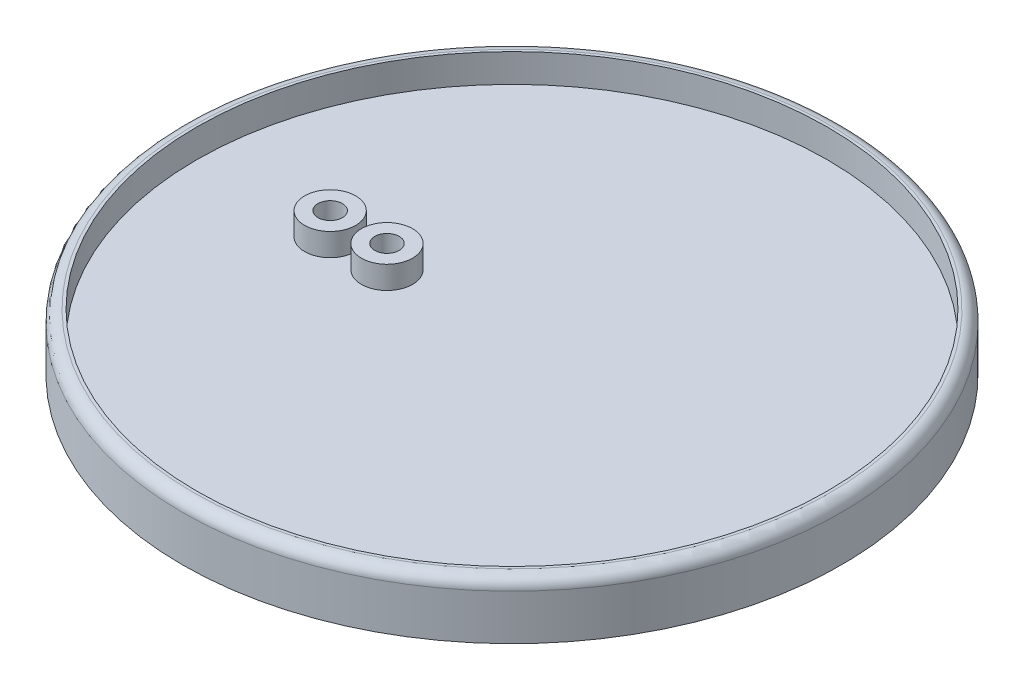
from build123d import *

# Parameters (mm, degrees)
SKETCH_1_R                            = 4.5
MOVING_POST_A_DEPTH                   = 9
SKETCH_2_R                            = 58
CUP_PLATE_D116_T5_DEPTH               = 5
SKETCH_3_R                            = 4.5
MOVING_POST_B_DEPTH                   = 9
SKETCH_4_R                            = 58
SKETCH_4_R_2                          = 55.5
DRIP_SKIRT_OD116_ID111_H10_DEPTH      = 10
SKETCH_5_R                            = 2.15
M4_MOVING_MOUNT_CLEARANCE_DEPTH       = 9
SKETCH_6_R                            = 4.5
M4_MOVING_HEAD_RECESS_D8P2_T2P7_DEPTH = 2.7
CUP_TOP_OUTER_ROUND_R2_R              = 2


with BuildPart() as part:
    # 草图1 → Moving_post_A (new body)
    with BuildSketch(Plane(origin=(0, 0, 0), x_dir=(1, 0, 0), z_dir=(0, 1, 0))):
        with Locations(Location((-22, 0, 0), (0, 0, 270))):
            Circle(SKETCH_1_R)
    extrude(amount=MOVING_POST_A_DEPTH)

    # 草图2 → Cup_plate_D116_T5 (add)
    with BuildSketch(Plane(origin=(0, 0, 0), x_dir=(1, 0, 0), z_dir=(0, 1, 0))):
        with Locations(Location((0, 0, 0), (0, 0, 270))):
            Circle(SKETCH_2_R)
    extrude(amount=CUP_PLATE_D116_T5_DEPTH)

    # 草图3 → Moving_post_B (add)
    with BuildSketch(Plane(origin=(0, 0, 0), x_dir=(1, 0, 0), z_dir=(0, 1, 0))):
        with Locations(Location((-32, 0, 0), (0, 0, 270))):
            Circle(SKETCH_3_R)
    extrude(amount=MOVING_POST_B_DEPTH)

    # 草图4 → Drip_skirt_OD116_ID111_H10 (add)
    with BuildSketch(Plane(origin=(0, 0, 0), x_dir=(1, 0, 0), z_dir=(0, 1, 0))):
        with Locations(Location((0, 0, 0), (0, 0, 270))):
            Circle(SKETCH_4_R)
        with Locations(Location((0, 0, 0), (0, 0, 270))):
            Circle(SKETCH_4_R_2, mode=Mode.SUBTRACT)
    extrude(amount=DRIP_SKIRT_OD116_ID111_H10_DEPTH)

    # 草图5 → M4_moving_mount_clearance (cut)
    with BuildSketch(Plane(origin=(0, 0, 0), x_dir=(1, 0, 0), z_dir=(0, 1, 0))):
        with Locations(Location((-22, 0, 0), (0, 0, 270))):
            Circle(SKETCH_5_R)
        with Locations(Location((-32, 0, 0), (0, 0, 270))):
            Circle(SKETCH_5_R)
    extrude(amount=M4_MOVING_MOUNT_CLEARANCE_DEPTH, mode=Mode.SUBTRACT)

    # 草图6 → M4_moving_head_recess_D8p2_T2p7 (cut)
    with BuildSketch(Plane(origin=(0, 0, 0), x_dir=(1, 0, 0), z_dir=(0, 1, 0))):
        with Locations(Location((-22, 0, 0), (0, 0, 270))):
            Circle(SKETCH_6_R)
        with Locations(Location((-32, 0, 0), (0, 0, 270))):
            Circle(SKETCH_6_R)
    extrude(amount=M4_MOVING_HEAD_RECESS_D8P2_T2P7_DEPTH, mode=Mode.SUBTRACT)

    # Cup_top_outer_round_R2
    cup_top_outer_round_r2_edges = [part.edges().sort_by_distance(p)[0] for p in [
        (0, 10, -58),
    ]]
    fillet(cup_top_outer_round_r2_edges, radius=CUP_TOP_OUTER_ROUND_R2_R)


solid = part.part
